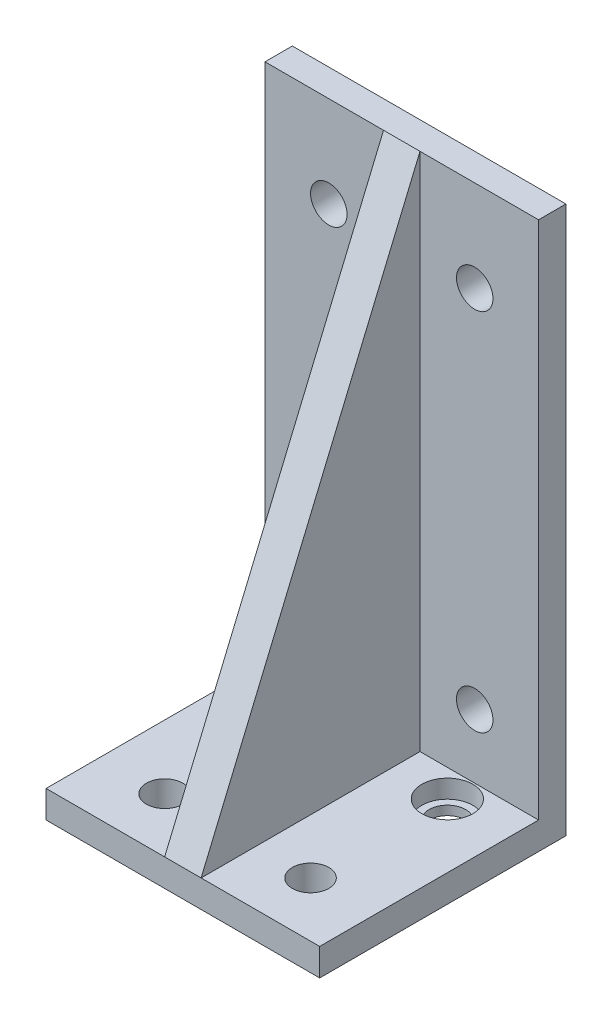
from build123d import *

# Parameters (mm, degrees)
SKETCH1_W           = 30
SKETCH1_H           = 60
SKETCH1_R           = 2
BOSS_EXTRUDE1_DEPTH = 3
SKETCH2_W           = 24
SKETCH2_H           = 3
BOSS_EXTRUDE2_DEPTH = 15
SKETCH3_R           = 2
CUT_EXTRUDE1_DEPTH  = 65.830548355
BOSS_EXTRUDE3_DEPTH = 2
SKETCH4_R           = 2.8
CUT_EXTRUDE2_DEPTH  = 2


with BuildPart() as part:
    # Sketch1 → Boss-Extrude1 (new body)
    with BuildSketch(Plane.XY):
        Rectangle(SKETCH1_W, SKETCH1_H)
        with Locations((8, 20)):
            Circle(SKETCH1_R, mode=Mode.SUBTRACT)
        with Locations(Location((8, -20, 0), (0, 0, 180))):
            Circle(SKETCH1_R, mode=Mode.SUBTRACT)
        with Locations(Location((-8, 20, 0), (0, 0, 180))):
            Circle(SKETCH1_R, mode=Mode.SUBTRACT)
        with Locations((-8, -20)):
            Circle(SKETCH1_R, mode=Mode.SUBTRACT)
    extrude(amount=BOSS_EXTRUDE1_DEPTH)

    # Sketch2 → Boss-Extrude2 (add, symmetric)
    with BuildSketch(Plane(origin=(0, 0, 0), x_dir=(0, 0, -1), z_dir=(1, 0, 0))):
        with Locations((-15, -28.5)):
            Rectangle(SKETCH2_W, SKETCH2_H)
    extrude(amount=BOSS_EXTRUDE2_DEPTH, both=True)

    # Sketch3 → Cut-Extrude1 (cut, through all)
    with BuildSketch(Plane(origin=(0, -27, 0), x_dir=(1, 0, 0), z_dir=(0, 1, 0))):
        with Locations(Location((-8, -6, 0), (0, 0, 270))):
            Circle(SKETCH3_R)
        with Locations(Location((8, -6, 0), (0, 0, 270))):
            Circle(SKETCH3_R)
        with Locations(Location((-8, -21, 0), (0, 0, 270))):
            Circle(SKETCH3_R)
        with Locations(Location((8, -21, 0), (0, 0, 270))):
            Circle(SKETCH3_R)
    extrude(amount=-CUT_EXTRUDE1_DEPTH, mode=Mode.SUBTRACT)

    # Sketch6 → Boss-Extrude3 (add, symmetric)
    with BuildSketch(Plane(origin=(0, 0, 0), x_dir=(0, 0, -1), z_dir=(1, 0, 0))):
        Polygon((-3, 30), (-27, -27), (-3, -27), align=None)
    extrude(amount=BOSS_EXTRUDE3_DEPTH, both=True)

    # Sketch4 → Cut-Extrude2 (cut)
    with BuildSketch(Plane(origin=(0, -27, 0), x_dir=(1, 0, 0), z_dir=(0, 1, 0))):
        with Locations(Location((-8, -6, 0), (0, 0, 270))):
            Circle(SKETCH4_R)
        with Locations(Location((8, -6, 0), (0, 0, 270))):
            Circle(SKETCH4_R)
    extrude(amount=-CUT_EXTRUDE2_DEPTH, mode=Mode.SUBTRACT)


solid = part.part
